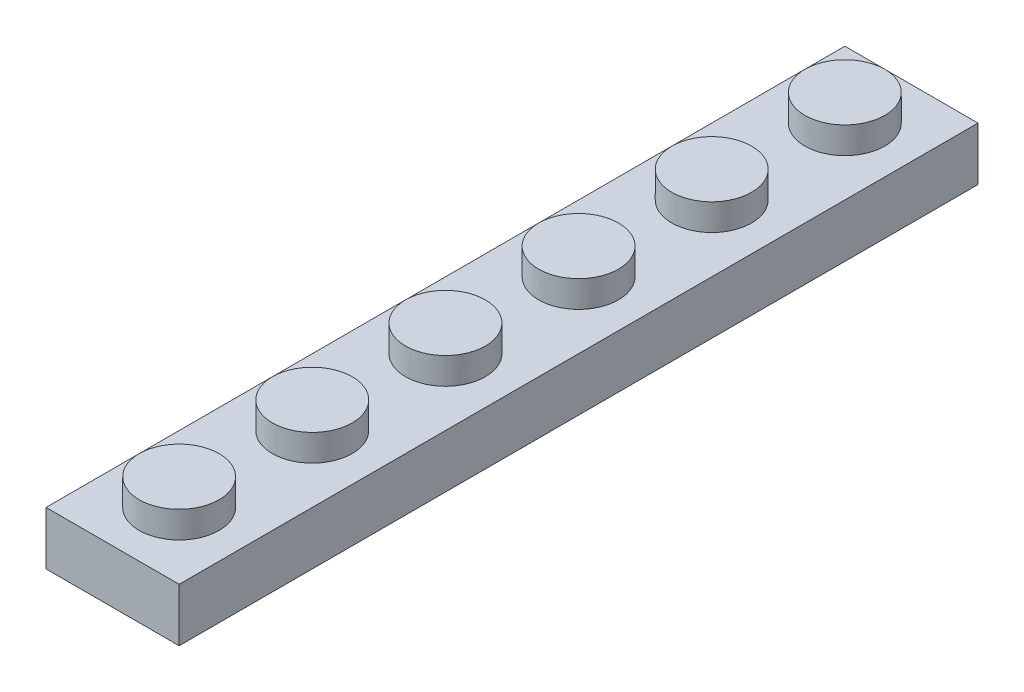
from build123d import *

# Parameters (mm, degrees)
SKETCH1_W            = 8
SKETCH1_H            = 48
BOSS_EXTRUDE1_DEPTH  = 3.2
SKETCH2_R            = 2.4
BOSS_EXTRUDE2_DEPTH  = 1.6
LPATTERN1_COUNT      = 2
LPATTERN1_PITCH      = 8
LPATTERN1_COUNT_DIR2 = 6
LPATTERN1_PITCH_DIR2 = 8
SHELL1_T             = -1.6


with BuildPart() as part:
    # Sketch1 → Boss-Extrude1 (new body)
    with BuildSketch(Plane(origin=(0, 0, 0), x_dir=(1, 0, 0), z_dir=(0, 1, 0))):
        with Locations((4, 24)):
            Rectangle(SKETCH1_W, SKETCH1_H)
    extrude(amount=BOSS_EXTRUDE1_DEPTH)

    # Sketch2 → Boss-Extrude2 (add)
    with BuildSketch(Plane(origin=(0, 3.2, 0), x_dir=(1, 0, 0), z_dir=(0, 1, 0))):
        with Locations(Location((4, 4, 0), (0, 0, 90))):
            Circle(SKETCH2_R)
    boss_extrude2 = extrude(amount=BOSS_EXTRUDE2_DEPTH)

    # LPattern1: Boss-Extrude2 2 × 6, 6 skipped
    with Locations(*[(i * LPATTERN1_PITCH, 0, -j * LPATTERN1_PITCH_DIR2) for i in range(LPATTERN1_COUNT) for j in range(LPATTERN1_COUNT_DIR2) if (i, j) not in ((0, 0), (1, 0), (1, 1), (1, 2), (1, 3), (1, 4), (1, 5))]):
        add(boss_extrude2)

    # Shell1
    shell1_openings = [part.faces().sort_by_distance(p)[0] for p in [
        (4, 0, -24),
    ]]
    offset(amount=SHELL1_T, openings=shell1_openings, kind=Kind.INTERSECTION)


solid = part.part
